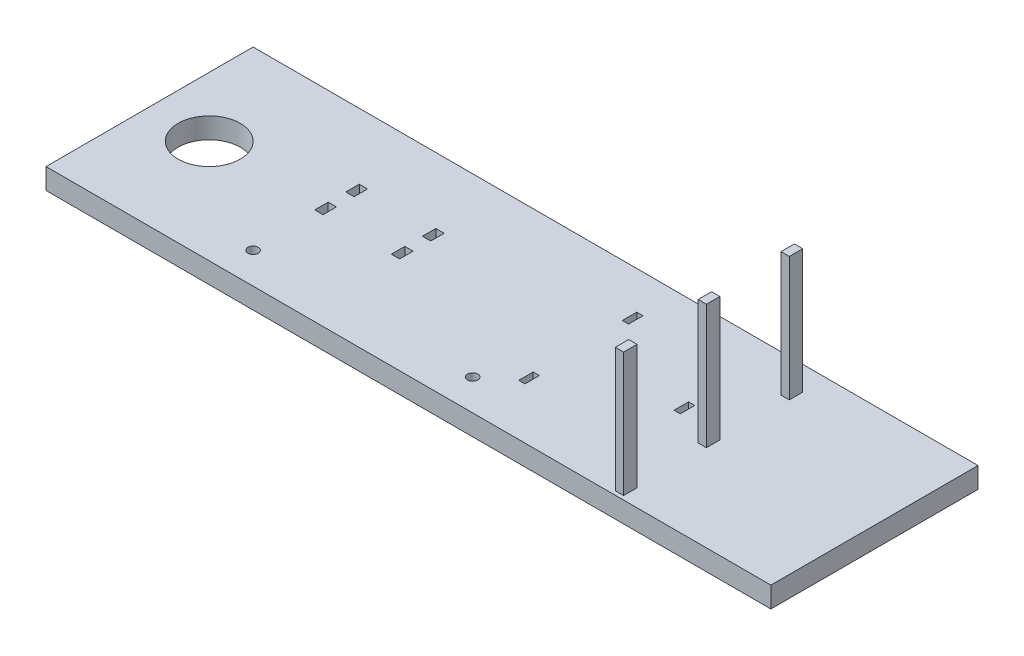
from build123d import *

# Parameters (mm, degrees)
SKETCH1_W           = 35
SKETCH1_H           = 10
BOSS_EXTRUDE1_DEPTH = 1
SKETCH2_R           = 0.25
SKETCH2_R_2         = 1.5
SKETCH2_W           = 0.4
SKETCH2_H           = 0.65
SKETCH2_W_2         = 0.3
SKETCH2_H_2         = 0.7
CUT_EXTRUDE1_DEPTH  = 1
SKETCH3_W           = 0.4
SKETCH3_H           = 0.65
BOSS_EXTRUDE2_DEPTH = 6


with BuildPart() as part:
    # Sketch1 → Boss-Extrude1 (new body)
    with BuildSketch(Plane(origin=(0, 0, 0), x_dir=(1, 0, 0), z_dir=(0, 1, 0))):
        Rectangle(SKETCH1_W, SKETCH1_H)
    extrude(amount=BOSS_EXTRUDE1_DEPTH)

    # Sketch2 → Cut-Extrude1 (cut)
    with BuildSketch(Plane.XZ):
        with Locations(Location((-9, 3.5, 0), (0, 0, 270))):
            Circle(SKETCH2_R)
        with Locations(Location((1.6, 3.5, 0), (0, 0, 270))):
            Circle(SKETCH2_R)
        with Locations(Location((-14.620013046, 0, 0), (0, 0, 270))):
            Circle(SKETCH2_R_2)
        with Locations((-9, 0)):
            Rectangle(SKETCH2_W, SKETCH2_H)
        with Locations((-9, -1.5)):
            Rectangle(SKETCH2_W, SKETCH2_H)
        with Locations((-5.3, 0)):
            Rectangle(SKETCH2_W, SKETCH2_H)
        with Locations((-5.3, -1.5)):
            Rectangle(SKETCH2_W, SKETCH2_H)
        with Locations((8, -0.325)):
            Rectangle(SKETCH2_W_2, SKETCH2_H_2)
        with Locations((3, 2.175)):
            Rectangle(SKETCH2_W_2, SKETCH2_H_2)
        with Locations((3, -2.825)):
            Rectangle(SKETCH2_W_2, SKETCH2_H_2)
    extrude(amount=-CUT_EXTRUDE1_DEPTH, mode=Mode.SUBTRACT)

    # Sketch3 → Boss-Extrude2 (add)
    with BuildSketch(Plane(origin=(0, 1, 0), x_dir=(1, 0, 0), z_dir=(0, 1, 0))):
        with Locations((10, -0.487564974)):
            Rectangle(SKETCH3_W, SKETCH3_H)
        with Locations((10, 3.512435026)):
            Rectangle(SKETCH3_W, SKETCH3_H)
        with Locations((10, -4.487564974)):
            Rectangle(SKETCH3_W, SKETCH3_H)
    extrude(amount=BOSS_EXTRUDE2_DEPTH)


solid = part.part
